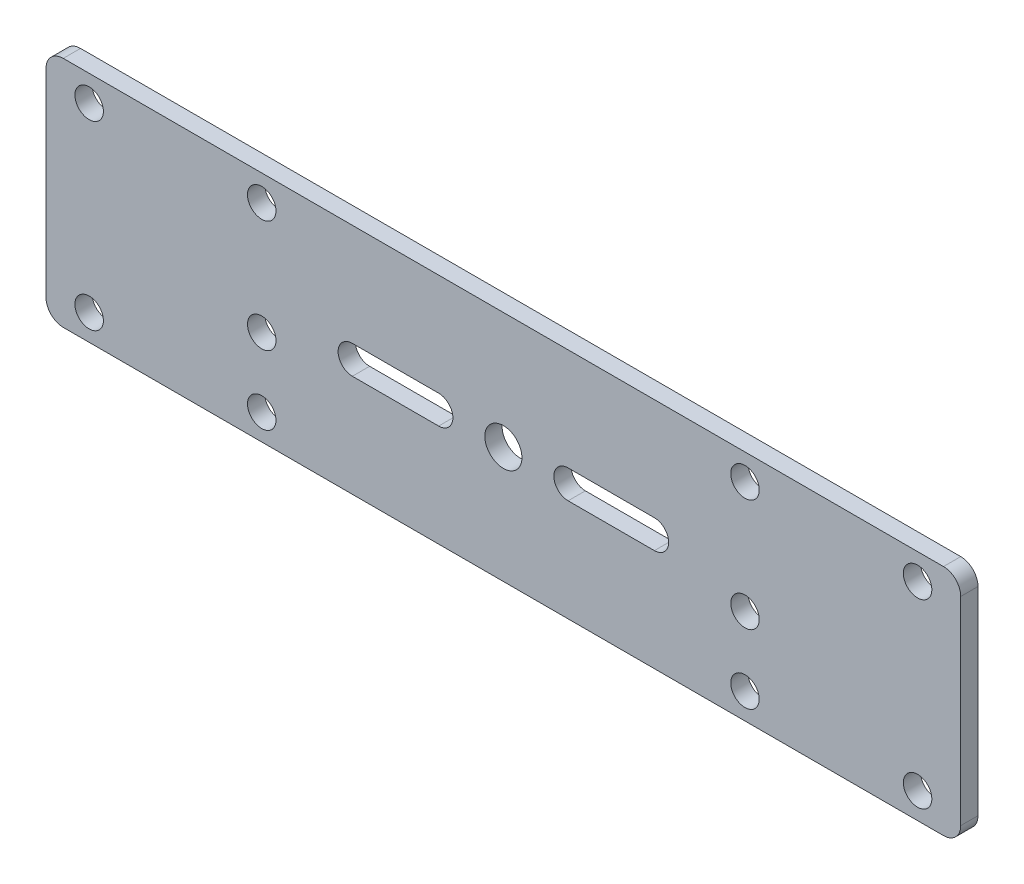
from build123d import *

# Parameters (mm, degrees)
SKETCH_1_W          = 106
SKETCH_1_H          = 25
SKETCH_1_R          = 1.65
SKETCH_1_R_2        = 2.15
EXTRUDE_1_DEPTH     = 2
SKETCH_2_W          = 106
SKETCH_2_H          = 6
EXTRUDE_3_DEPTH     = 2
SKETCH_4_R          = 1.65
CUT_EXTRUDE_1_DEPTH = 57.171612047
CUT_EXTRUDE_2_DEPTH = 10
SKETCH_6_W          = 106
SKETCH_6_H          = 4
CUT_EXTRUDE_3_DEPTH = 57.171612047
FILLET_1_R          = 2


with BuildPart() as part:
    # 草图1 → 凸台-拉伸1 (new body)
    with BuildSketch(Plane.XY):
        Rectangle(SKETCH_1_W, SKETCH_1_H)
        with Locations((-28, 5.5)):
            Circle(SKETCH_1_R, mode=Mode.SUBTRACT)
        with Locations(Location((-28, -7.5, 0), (0, 0, 180))):
            Circle(SKETCH_1_R, mode=Mode.SUBTRACT)
        with Locations((28, -7.5)):
            Circle(SKETCH_1_R, mode=Mode.SUBTRACT)
        with Locations(Location((28, 5.5, 0), (0, 0, 180))):
            Circle(SKETCH_1_R, mode=Mode.SUBTRACT)
        with Locations((-48, 5.5)):
            Circle(SKETCH_1_R, mode=Mode.SUBTRACT)
        with Locations(Location((48, 5.5, 0), (0, 0, 180))):
            Circle(SKETCH_1_R, mode=Mode.SUBTRACT)
        with Locations((0, -5)):
            Circle(SKETCH_1_R_2, mode=Mode.SUBTRACT)
    extrude(amount=EXTRUDE_1_DEPTH)

    # 草图2 → 凸台-拉伸3 (add)
    with BuildSketch(Plane.XY.offset(2)):
        with Locations((0, -15.5)):
            Rectangle(SKETCH_2_W, SKETCH_2_H)
    extrude(amount=-EXTRUDE_3_DEPTH)

    # 草图4 → 切除-拉伸1 (cut, through all)
    with BuildSketch(Plane.XY.offset(2)):
        with Locations((-48, -15.5)):
            Circle(SKETCH_4_R)
        with Locations(Location((48, -15.5, 0), (0, 0, 180))):
            Circle(SKETCH_4_R)
        with Locations((-28, -15.5)):
            Circle(SKETCH_4_R)
        with Locations(Location((28, -15.5, 0), (0, 0, 180))):
            Circle(SKETCH_4_R)
    extrude(amount=-CUT_EXTRUDE_1_DEPTH, mode=Mode.SUBTRACT)

    # 草图5 → 切除-拉伸2 (cut)
    with BuildSketch(Plane.XY.offset(2)):
        with BuildLine():
            Line((-17.5, -3.35), (-7.5, -3.35))
            ThreePointArc((-7.5, -3.35), (-5.85, -5), (-7.5, -6.65))
            Line((-7.5, -6.65), (-17.5, -6.65))
            ThreePointArc((-17.5, -6.65), (-19.15, -5), (-17.5, -3.35))
        make_face()
        with BuildLine():
            Line((17.5, -3.35), (7.5, -3.35))
            ThreePointArc((7.5, -3.35), (5.85, -5), (7.5, -6.65))
            Line((7.5, -6.65), (17.5, -6.65))
            ThreePointArc((17.5, -6.65), (19.15, -5), (17.5, -3.35))
        make_face()
    extrude(amount=-CUT_EXTRUDE_2_DEPTH, mode=Mode.SUBTRACT)

    # 草图6 → 切除-拉伸3 (cut, through all)
    with BuildSketch(Plane.XY.offset(2)):
        with Locations((0, 10.5)):
            Rectangle(SKETCH_6_W, SKETCH_6_H)
    extrude(amount=-CUT_EXTRUDE_3_DEPTH, mode=Mode.SUBTRACT)

    # 圆角1
    fillet_1_edges = [part.edges().sort_by_distance(p)[0] for p in [
        (-53, 8.5, 1),
        (53, 8.5, 1),
        (-53, -18.5, 1),
        (53, -18.5, 1),
    ]]
    fillet(fillet_1_edges, radius=FILLET_1_R)


solid = part.part
